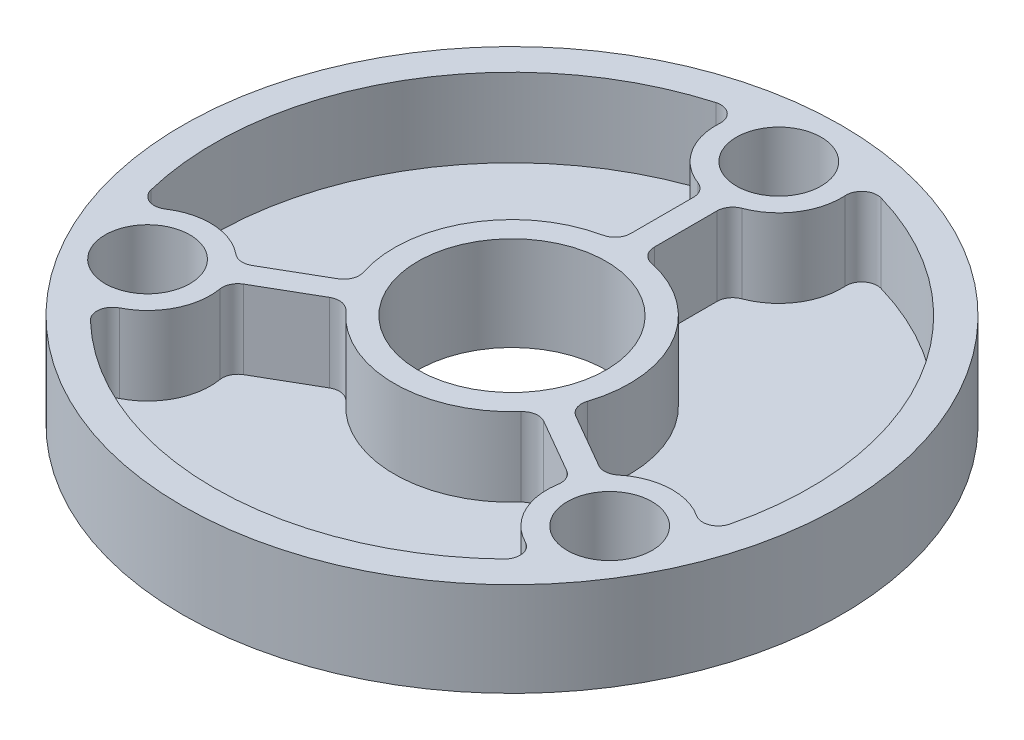
from build123d import *

# Parameters (mm, degrees)
SKETCH1_R           = 21
SKETCH1_R_2         = 6
BOSS_EXTRUDE1_DEPTH = 1
SKETCH2_R           = 21
SKETCH2_R_2         = 2.7
SKETCH2_R_3         = 6
BOSS_EXTRUDE2_DEPTH = 5
SKETCH3_R           = 1.3
CUT_EXTRUDE1_DEPTH  = 4


with BuildPart() as part:
    # Sketch1 → Boss-Extrude1 (new body)
    with BuildSketch(Plane(origin=(0, 0, 0), x_dir=(1, 0, 0), z_dir=(0, 1, 0))):
        with Locations(Location((0, 0, 0), (0, 0, 270))):
            Circle(SKETCH1_R)
        with Locations(Location((0, 0, 0), (0, 0, 270))):
            Circle(SKETCH1_R_2, mode=Mode.SUBTRACT)
    extrude(amount=BOSS_EXTRUDE1_DEPTH)

    # Sketch2 → Boss-Extrude2 (add)
    with BuildSketch(Plane(origin=(0, 1, 0), x_dir=(1, 0, 0), z_dir=(0, 1, 0))):
        with Locations(Location((0, 0, 0), (0, 0, 270))):
            Circle(SKETCH2_R)
        with Locations(Location((0, 17, 0), (0, 0, 270))):
            Circle(SKETCH2_R_2, mode=Mode.SUBTRACT)
        with Locations(Location((14.722431864, -8.5, 0), (0, 0, 270))):
            Circle(SKETCH2_R_2, mode=Mode.SUBTRACT)
        with Locations(Location((-14.722431864, -8.5, 0), (0, 0, 270))):
            Circle(SKETCH2_R_2, mode=Mode.SUBTRACT)
        with Locations(Location((0, 0, 0), (0, 0, 270))):
            Circle(SKETCH2_R_3, mode=Mode.SUBTRACT)
        with BuildLine():
            Line((-0.75, 12.316251501), (-0.75, 8.31790238))
            ThreePointArc((-0.75, 8.31790238), (-0.97350713, 7.687776342), (-1.544117647, 7.339325629))
            ThreePointArc((-1.544117647, 7.339325629), (-6.495190528, 3.75), (-7.128101265, -2.332417706))
            ThreePointArc((-7.128101265, -2.332417706), (-7.144563176, -3.000806265), (-7.578514767, -3.509432137))
            Line((-7.578514767, -3.509432137), (-11.041186679, -5.508606698))
            ThreePointArc((-11.041186679, -5.508606698), (-11.624105203, -5.639137624), (-12.177435716, -5.414065035))
            ThreePointArc((-12.177435716, -5.414065035), (-14.508194092, -4.505741348), (-16.922739342, -5.159543893))
            ThreePointArc((-16.922739342, -5.159543893), (-17.83709693, -5.255719057), (-18.443528223, -4.564675969))
            ThreePointArc((-18.443528223, -4.564675969), (-16.454482672, 9.5), (-5.268638762, 18.254901961))
            ThreePointArc((-5.268638762, 18.254901961), (-4.366962246, 18.075238599), (-3.993073588, 17.235294118))
            ThreePointArc((-3.993073588, 17.235294118), (-3.352010576, 14.817335321), (-1.4, 13.253001201))
            ThreePointArc((-1.4, 13.253001201), (-0.928416164, 12.886339214), (-0.75, 12.316251501))
        make_face(mode=Mode.SUBTRACT)
        with BuildLine():
            Line((0.75, 12.316251501), (0.75, 8.31790238))
            ThreePointArc((0.75, 8.31790238), (0.97350713, 7.687776342), (1.544117647, 7.339325629))
            ThreePointArc((1.544117647, 7.339325629), (6.495190528, 3.75), (7.128101265, -2.332417706))
            ThreePointArc((7.128101265, -2.332417706), (7.144563176, -3.000806265), (7.578514767, -3.509432137))
            Line((7.578514767, -3.509432137), (11.041186679, -5.508606698))
            ThreePointArc((11.041186679, -5.508606698), (11.624105203, -5.639137624), (12.177435716, -5.414065035))
            ThreePointArc((12.177435716, -5.414065035), (14.508194092, -4.505741348), (16.922739342, -5.159543893))
            ThreePointArc((16.922739342, -5.159543893), (17.83709693, -5.255719057), (18.443528223, -4.564675969))
            ThreePointArc((18.443528223, -4.564675969), (16.454482672, 9.5), (5.268638762, 18.254901961))
            ThreePointArc((5.268638762, 18.254901961), (4.366962246, 18.075238599), (3.993073588, 17.235294118))
            ThreePointArc((3.993073588, 17.235294118), (3.352010576, 14.817335321), (1.4, 13.253001201))
            ThreePointArc((1.4, 13.253001201), (0.928416164, 12.886339214), (0.75, 12.316251501))
        make_face(mode=Mode.SUBTRACT)
        with BuildLine():
            Line((10.291186679, -6.807644803), (6.828514767, -4.808470243))
            ThreePointArc((6.828514767, -4.808470243), (6.171056046, -4.686970077), (5.583983618, -5.006907923))
            ThreePointArc((5.583983618, -5.006907923), (0, -7.5), (-5.583983618, -5.006907923))
            ThreePointArc((-5.583983618, -5.006907923), (-6.171056046, -4.686970077), (-6.828514767, -4.808470243))
            Line((-6.828514767, -4.808470243), (-10.291186679, -6.807644803))
            ThreePointArc((-10.291186679, -6.807644803), (-10.695689039, -7.24720159), (-10.777435716, -7.838936166))
            ThreePointArc((-10.777435716, -7.838936166), (-11.156183517, -10.311593973), (-12.929665754, -12.075750225))
            ThreePointArc((-12.929665754, -12.075750225), (-13.470134683, -12.819519543), (-13.174889461, -13.690225991))
            ThreePointArc((-13.174889461, -13.690225991), (0, -19), (13.174889461, -13.690225991))
            ThreePointArc((13.174889461, -13.690225991), (13.470134683, -12.819519543), (12.929665754, -12.075750225))
            ThreePointArc((12.929665754, -12.075750225), (11.156183517, -10.311593973), (10.777435716, -7.838936166))
            ThreePointArc((10.777435716, -7.838936166), (10.695689039, -7.24720159), (10.291186679, -6.807644803))
        make_face(mode=Mode.SUBTRACT)
    extrude(amount=BOSS_EXTRUDE2_DEPTH)

    # Sketch3 → Cut-Extrude1 (cut)
    with BuildSketch(Plane(origin=(0, 1, 0), x_dir=(1, 0, 0), z_dir=(0, 1, 0))):
        with Locations(Location((-14.722431864, -8.5, 0), (0, 0, 270))):
            Circle(SKETCH3_R)
        with Locations(Location((14.722431864, -8.5, 0), (0, 0, 270))):
            Circle(SKETCH3_R)
        with Locations(Location((0, 17, 0), (0, 0, 270))):
            Circle(SKETCH3_R)
    extrude(amount=-CUT_EXTRUDE1_DEPTH, mode=Mode.SUBTRACT)


solid = part.part
